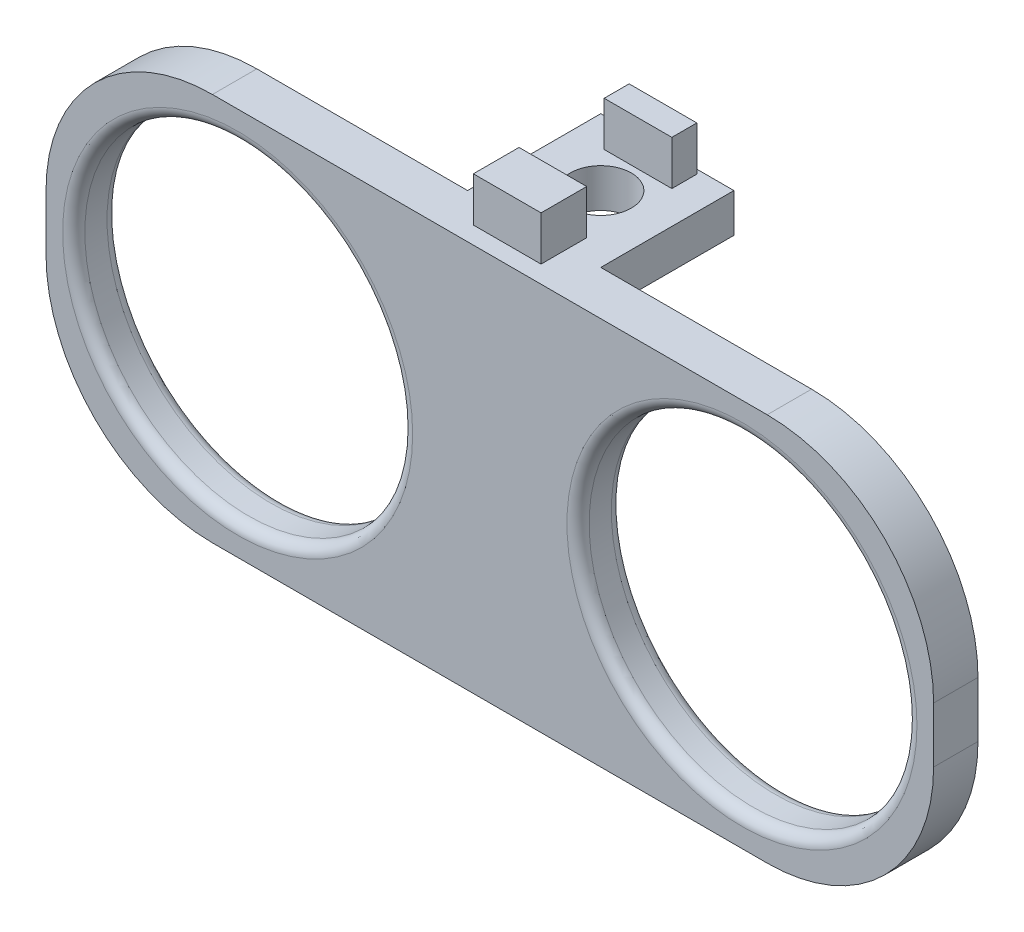
from build123d import *

# Parameters (mm, degrees)
SKETCH1_W            = 80
SKETCH1_H            = 35
BOSS_EXTRUDE1_DEPTH  = 4
SKETCH2_R            = 14.775
CUT_EXTRUDE1_DEPTH   = 4
FILLET2_R            = 15
SKETCH3_W            = 12
SKETCH3_H            = 3.5
BOSS_EXTRUDE2_DEPTH  = 12
SKETCH4_R            = 2.75
CUT_EXTRUDE2_DEPTH   = 5
FILLET4_R            = 1
FILLET4_OF_MIRROR4_R = 1
FILLET5_R            = 15
SKETCH6_W            = 6.1
SKETCH6_H            = 2.250320618
SKETCH6_H_2          = 4.114705986
BOSS_EXTRUDE3_DEPTH  = 4


with BuildPart() as part:
    # Sketch1 → Boss-Extrude1 (new body)
    with BuildSketch(Plane.XY):
        Rectangle(SKETCH1_W, SKETCH1_H)
    extrude(amount=BOSS_EXTRUDE1_DEPTH)

    # Sketch2 → Cut-Extrude1 (cut)
    with BuildSketch(Plane.XY.offset(4)):
        with Locations((22.725, 0)):
            Circle(SKETCH2_R)
    cut_extrude1 = extrude(amount=-CUT_EXTRUDE1_DEPTH, mode=Mode.SUBTRACT)

    # Fillet2
    fillet2_edges = [part.edges().sort_by_distance(p)[0] for p in [
        (40, -17.5, 2),
        (-40, -17.5, 2),
    ]]
    fillet(fillet2_edges, radius=FILLET2_R)

    # Sketch3 → Boss-Extrude2 (add)
    with BuildSketch(Plane(origin=(0, 0, 0), x_dir=(-1, 0, 0), z_dir=(0, 0, -1))):
        with Locations((0, 15.75)):
            Rectangle(SKETCH3_W, SKETCH3_H)
    extrude(amount=BOSS_EXTRUDE2_DEPTH)

    # Sketch4 → Cut-Extrude2 (cut)
    with BuildSketch(Plane.XZ.offset(-14)):
        with Locations(Location((0, -6, 0), (0, 0, 270))):
            Circle(SKETCH4_R)
    extrude(amount=-CUT_EXTRUDE2_DEPTH, mode=Mode.SUBTRACT)

    # Fillet4
    fillet4_edges = [part.edges().sort_by_distance(p)[0] for p in [
        (7.95, 0, 0),
        (7.95, 0, 4),
    ]]
    fillet(fillet4_edges, radius=FILLET4_R)

    # Mirror4: Cut-Extrude1 across plane
    add(cut_extrude1.mirror(Plane(origin=(0, 0, 0), x_dir=(0, 0, 1), z_dir=(1, 0, 0))), mode=Mode.SUBTRACT)

    # Fillet4 of Mirror4
    fillet4_of_mirror4_edges = [part.edges().sort_by_distance(p)[0] for p in [
        (-7.95, 0, 0),
        (-7.95, 0, 4),
    ]]
    fillet(fillet4_of_mirror4_edges, radius=FILLET4_OF_MIRROR4_R)

    # Fillet5
    fillet5_edges = [part.edges().sort_by_distance(p)[0] for p in [
        (-40, 17.5, 2),
        (40, 17.5, 2),
    ]]
    fillet(fillet5_edges, radius=FILLET5_R)

    # Sketch6 → Boss-Extrude3 (add)
    with BuildSketch(Plane(origin=(0, 17.5, 0), x_dir=(1, 0, 0), z_dir=(0, 1, 0))):
        with Locations((0, 10.482941872)):
            Rectangle(SKETCH6_W, SKETCH6_H)
        with Locations((0, -0.375)):
            Rectangle(SKETCH6_W, SKETCH6_H_2)
    extrude(amount=BOSS_EXTRUDE3_DEPTH)


solid = part.part
